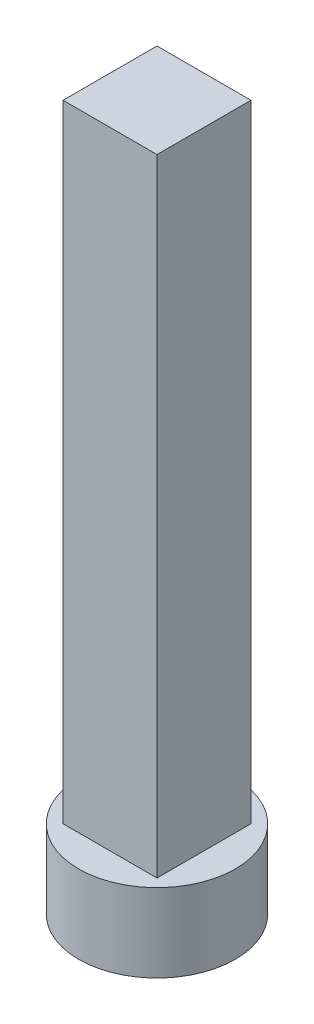
from build123d import *

# Parameters (mm, degrees)
SKETCH_1_W      = 60
SKETCH_1_H      = 60
EXTRUDE_1_DEPTH = 400
SKETCH_2_R      = 50
EXTRUDE_2_DEPTH = 50


with BuildPart() as part:
    # 草图1 → 凸台-拉伸1 (new body)
    with BuildSketch(Plane(origin=(0, 0, 0), x_dir=(1, 0, 0), z_dir=(0, 1, 0))):
        Rectangle(SKETCH_1_W, SKETCH_1_H)
    extrude(amount=EXTRUDE_1_DEPTH)

    # 草图2 → 凸台-拉伸2 (add)
    with BuildSketch(Plane.XZ):
        with Locations(Location((0, 0, 0), (0, 0, 270))):
            Circle(SKETCH_2_R)
    extrude(amount=EXTRUDE_2_DEPTH)


solid = part.part
